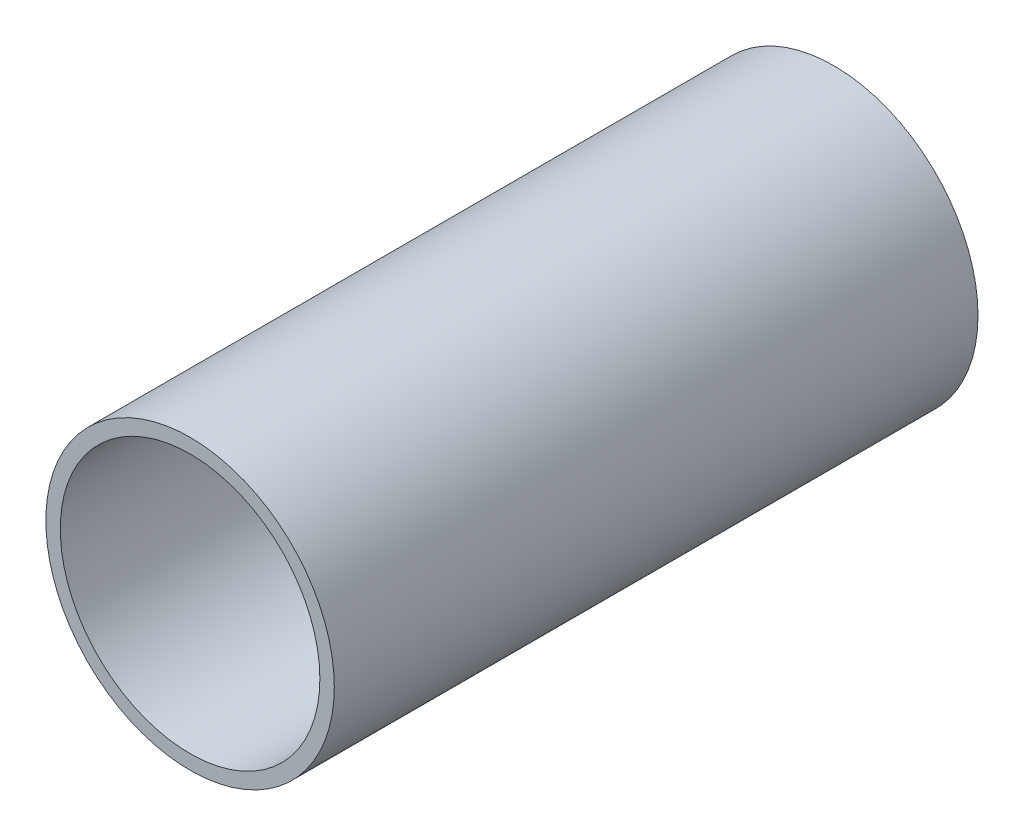
from build123d import *

# Parameters (mm, degrees)
SKETCH1_R           = 20
SKETCH1_R_2         = 18
BOSS_EXTRUDE1_DEPTH = 89.2635


with BuildPart() as part:
    # Sketch1 → Boss-Extrude1 (new body)
    with BuildSketch(Plane.XY):
        Circle(SKETCH1_R)
        Circle(SKETCH1_R_2, mode=Mode.SUBTRACT)
    extrude(amount=BOSS_EXTRUDE1_DEPTH)


solid = part.part
